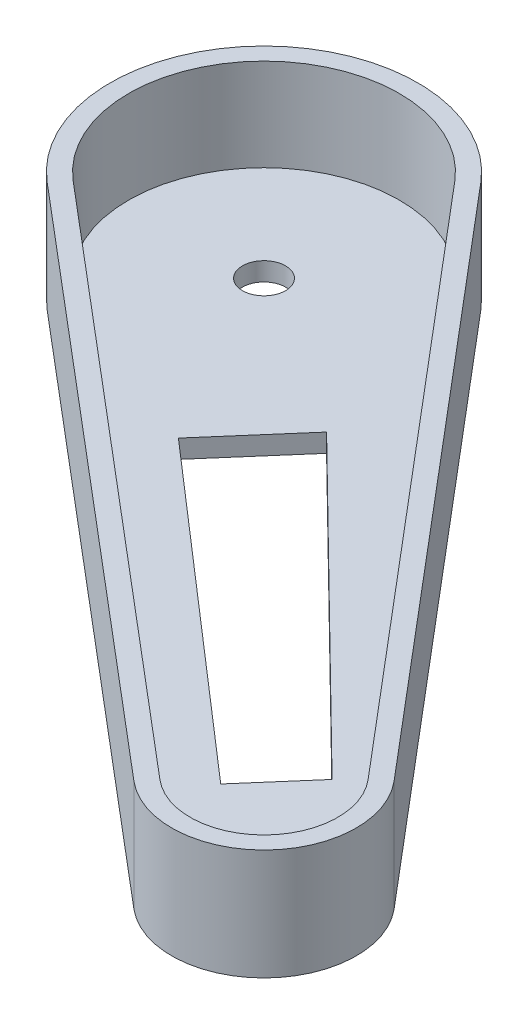
from build123d import *

# Parameters (mm, degrees)
EXTRUDE_2_DEPTH     = 3
SKETCH_4_R          = 2.25
SKETCH_4_R_2        = 2.5
CUT_EXTRUDE_2_DEPTH = 96.402519291
SKETCH_6_R          = 3.5
CUT_EXTRUDE_3_DEPTH = 96.402519291
SKETCH_7_R          = 3.5
CUT_EXTRUDE_4_DEPTH = 96.402519291
CUT_EXTRUDE_5_DEPTH = 96.402519291
EXTRUDE_4_DEPTH     = 15


with BuildPart() as part:
    # 草图2 → 凸台-拉伸2 (new body)
    with BuildSketch(Plane(origin=(0, 0, 0), x_dir=(1, 0, 0), z_dir=(0, 1, 0))):
        with BuildLine():
            Line((-58.569449541, 23.337085947), (32.740581269, -53.879999426))
            ThreePointArc((32.740581269, -53.879999426), (53.033008589, -53.033008589), (53.879999426, -32.740581269))
            Line((53.879999426, -32.740581269), (-23.337085947, 58.569449541))
            ThreePointArc((-23.337085947, 58.569449541), (-60.104076401, 60.104076401), (-58.569449541, 23.337085947))
        make_face()
    extrude(amount=EXTRUDE_2_DEPTH)

    # 草图4 → 切除-拉伸2 (cut, through all)
    with BuildSketch(Plane(origin=(0, 3, 0), x_dir=(1, 0, 0), z_dir=(0, 1, 0))):
        with Locations(Location((-42.426406871, 42.426406871, 0), (0, 0, 270))):
            Circle(SKETCH_4_R)
        with Locations(Location((42.426406871, -42.426406871, 0), (0, 0, 270))):
            Circle(SKETCH_4_R_2)
    extrude(amount=-CUT_EXTRUDE_2_DEPTH, mode=Mode.SUBTRACT)

    # 草图6 → 切除-拉伸3 (cut, through all)
    with BuildSketch(Plane(origin=(0, 3, 0), x_dir=(1, 0, 0), z_dir=(0, 1, 0))):
        with Locations(Location((-42.426406871, 42.426406871, 0), (0, 0, 270))):
            Circle(SKETCH_6_R)
    extrude(amount=-CUT_EXTRUDE_3_DEPTH, mode=Mode.SUBTRACT)

    # 草图7 → 切除-拉伸4 (cut, through all)
    with BuildSketch(Plane(origin=(0, 3, 0), x_dir=(1, 0, 0), z_dir=(0, 1, 0))):
        with Locations(Location((42.426406871, -42.426406871, 0), (0, 0, 270))):
            Circle(SKETCH_7_R)
    extrude(amount=-CUT_EXTRUDE_4_DEPTH, mode=Mode.SUBTRACT)

    # 草图8 → 切除-拉伸5 (cut, through all)
    with BuildSketch(Plane(origin=(0, 3, 0), x_dir=(1, 0, 0), z_dir=(0, 1, 0))):
        Polygon((33.626672858, -22.564710472), (-15.702999665, 25.870376375), (-26.891422763, 12.98046534), (25.218843822, -32.251166492), align=None)
    extrude(amount=-CUT_EXTRUDE_5_DEPTH, mode=Mode.SUBTRACT)

    # 草图9 → 凸台-拉伸4 (add)
    with BuildSketch(Plane(origin=(0, 3, 0), x_dir=(1, 0, 0), z_dir=(0, 1, 0))):
        with BuildLine():
            ThreePointArc((-17.960284018, 47.565359346), (-19.96440182, 53.401757848), (-23.337085947, 58.569449541))
            ThreePointArc((-23.337085947, 58.569449541), (-60.104076401, 60.104076401), (-58.569449541, 23.337085947))
            ThreePointArc((-58.569449541, 23.337085947), (-53.401757848, 19.96440182), (-47.565359346, 17.960284018))
            Line((-47.565359346, 17.960284018), (-56.632284421, 25.627804458))
            ThreePointArc((-56.632284421, 25.627804458), (-57.982756057, 57.982756057), (-25.627804458, 56.632284421))
            Line((-25.627804458, 56.632284421), (-17.960284018, 47.565359346))
        make_face()
        with BuildLine():
            Line((53.879999426, -32.740581269), (-23.337085947, 58.569449541))
            ThreePointArc((-23.337085947, 58.569449541), (-19.96440182, 53.401757848), (-17.960284018, 47.565359346))
            Line((-17.960284018, 47.565359346), (45.777785554, -27.805590857))
            ThreePointArc((45.777785554, -27.805590857), (50.229311839, -29.615681908), (53.879999426, -32.740581269))
        make_face()
        with BuildLine():
            ThreePointArc((-47.565359346, 17.960284018), (-53.401757848, 19.96440182), (-58.569449541, 23.337085947))
            Line((-58.569449541, 23.337085947), (32.740581269, -53.879999426))
            ThreePointArc((32.740581269, -53.879999426), (29.615681908, -50.229311839), (27.805590857, -45.777785554))
            Line((27.805590857, -45.777785554), (-47.565359346, 17.960284018))
        make_face()
        with BuildLine():
            ThreePointArc((57.426406871, -42.426406871), (56.511929373, -37.26907657), (53.879999426, -32.740581269))
            ThreePointArc((53.879999426, -32.740581269), (50.229311839, -29.615681908), (45.777785554, -27.805590857))
            Line((45.777785554, -27.805590857), (51.589280915, -34.67774639))
            ThreePointArc((51.589280915, -34.67774639), (53.694824873, -38.30054263), (54.426406871, -42.426406871))
            ThreePointArc((54.426406871, -42.426406871), (47.47695507, -53.311808237), (34.67774639, -51.589280915))
            Line((34.67774639, -51.589280915), (27.805590857, -45.777785554))
            ThreePointArc((27.805590857, -45.777785554), (29.615681908, -50.229311839), (32.740581269, -53.879999426))
            ThreePointArc((32.740581269, -53.879999426), (48.73959212, -56.033158578), (57.426406871, -42.426406871))
        make_face()
    extrude(amount=EXTRUDE_4_DEPTH)


solid = part.part
